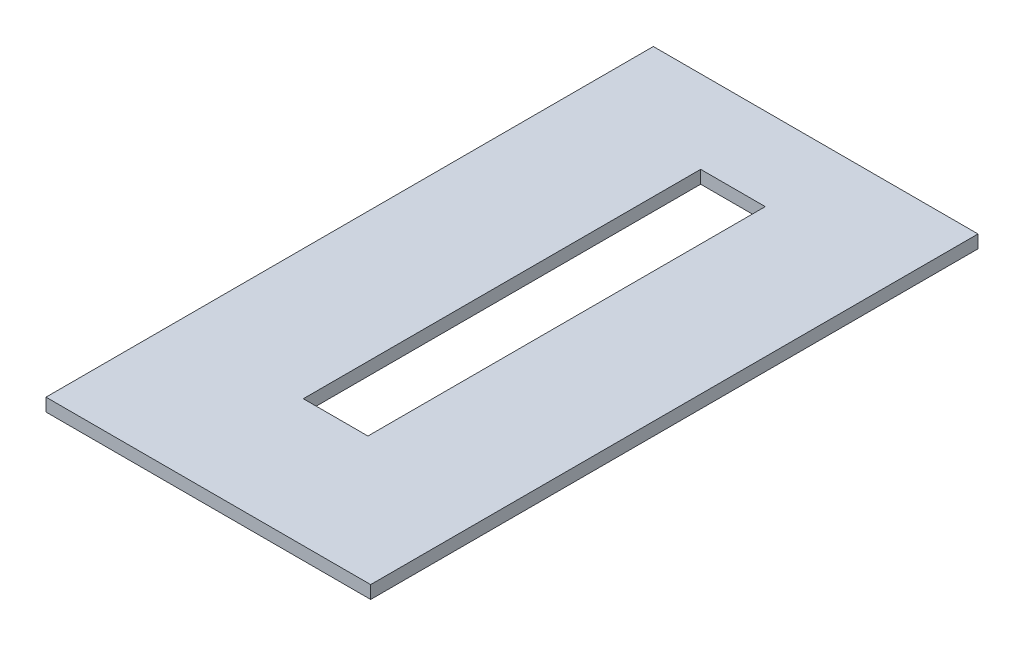
from build123d import *

# Parameters (mm, degrees)
SKETCH_1_W      = 5025
SKETCH_1_H      = 9400
SKETCH_1_W_2    = 1000
SKETCH_1_H_2    = 6150
EXTRUDE_1_DEPTH = 200


with BuildPart() as part:
    # Эскиз1 → Бобышка-Вытянуть1 (new body)
    with BuildSketch(Plane(origin=(0, 0, 0), x_dir=(1, 0, 0), z_dir=(0, 1, 0))):
        Rectangle(SKETCH_1_W, SKETCH_1_H)
        with Locations((0, 345)):
            Rectangle(SKETCH_1_W_2, SKETCH_1_H_2, mode=Mode.SUBTRACT)
    extrude(amount=-EXTRUDE_1_DEPTH)


solid = part.part
